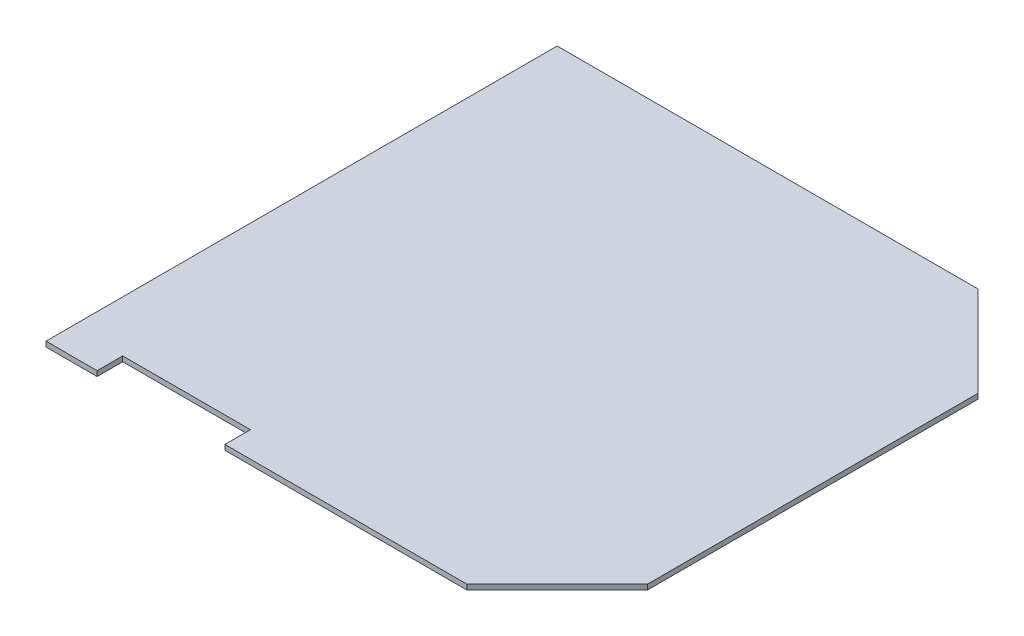
from build123d import *

# Parameters (mm, degrees)
BOSS_EXTRUDE1_DEPTH     = 2
CUT_EXTRUDE1_DEPTH      = 155.441036988
CUT_EXTRUDE1_DEPTH_BACK = 155.441036988
SKETCH2_W               = 50
SKETCH2_H               = 10


with BuildPart() as part:
    # Sketch1 → Boss-Extrude1 (new body)
    with BuildSketch(Plane(origin=(0, 0, 0), x_dir=(1, 0, 0), z_dir=(0, 1, 0))):
        Polygon((-82.32233047, 100), (82.32233047, 100), (117.67766953, 64.644660941), (117.67766953, -64.644660941), (82.32233047, -100), (-82.32233047, -100), align=None)
    extrude(amount=BOSS_EXTRUDE1_DEPTH)

    # Sketch2 → Cut-Extrude1 (cut, two sides: drawn at the far end of the back side and taken through both)
    with BuildSketch(Plane(origin=(0, 2, 0), x_dir=(1, 0, 0), z_dir=(0, 1, 0)).offset(-CUT_EXTRUDE1_DEPTH_BACK)):
        with Locations((-37.32233047, -95)):
            Rectangle(SKETCH2_W, SKETCH2_H)
    extrude(amount=CUT_EXTRUDE1_DEPTH + CUT_EXTRUDE1_DEPTH_BACK, mode=Mode.SUBTRACT)


solid = part.part
